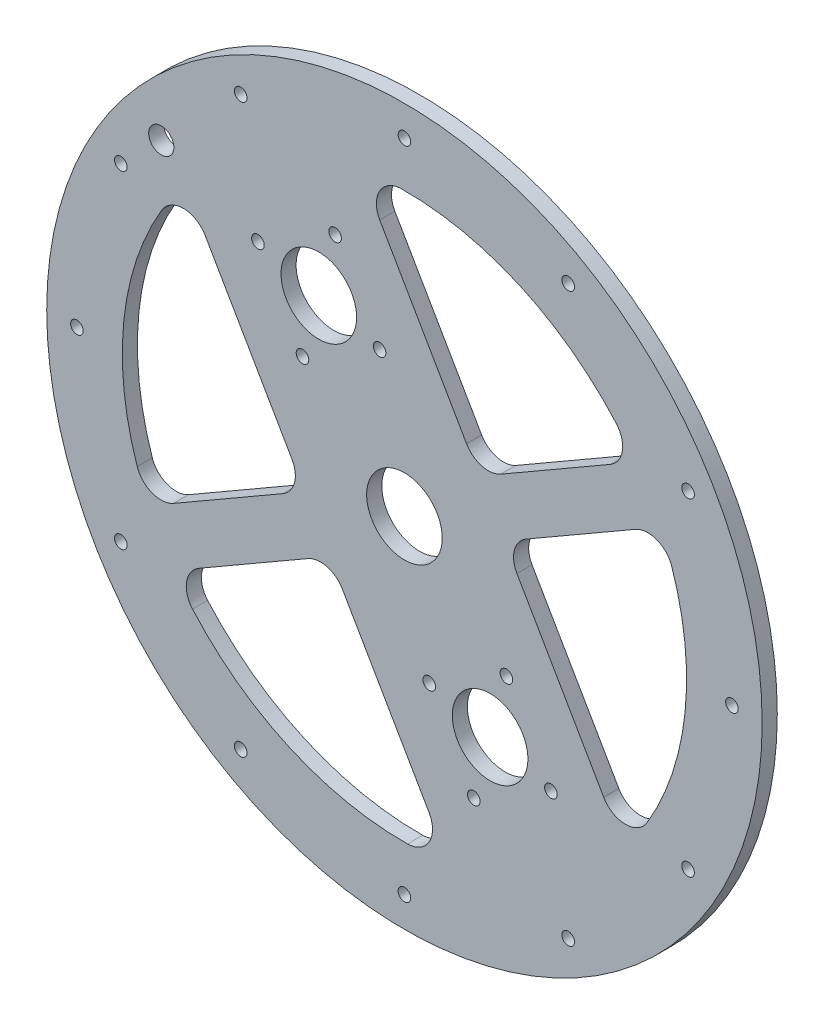
from build123d import *

# Parameters (mm, degrees)
SKETCH_1_R          = 71
SKETCH_1_R_2        = 1.25
SKETCH_1_R_3        = 7.5
EXTRUDE_1_DEPTH     = 3
CUT_EXTRUDE_1_REACH = 102.454
SKETCH_2_R          = 2.5
CUT_EXTRUDE_2_REACH = 102.454
CUT_EXTRUDE_3_REACH = 102.454
SKETCH_4_R          = 7.5
FILLET_1_R          = 5


with BuildPart() as part:
    # 草图1 → 凸台-拉伸1 (new body)
    with BuildSketch(Plane.XY):
        Circle(SKETCH_1_R)
        with Locations((0, 65)):
            Circle(SKETCH_1_R_2, mode=Mode.SUBTRACT)
        with Locations((56.291651246, 32.5)):
            Circle(SKETCH_1_R_2, mode=Mode.SUBTRACT)
        with Locations((56.291651246, -32.5)):
            Circle(SKETCH_1_R_2, mode=Mode.SUBTRACT)
        with Locations((0, -65)):
            Circle(SKETCH_1_R_2, mode=Mode.SUBTRACT)
        with Locations((-56.291651246, -32.5)):
            Circle(SKETCH_1_R_2, mode=Mode.SUBTRACT)
        with Locations((-56.291651246, 32.5)):
            Circle(SKETCH_1_R_2, mode=Mode.SUBTRACT)
        with Locations((-29.074072829, 32.680101792)):
            Circle(SKETCH_1_R_2, mode=Mode.SUBTRACT)
        with Locations((-13.764761936, 41.518936557)):
            Circle(SKETCH_1_R_2, mode=Mode.SUBTRACT)
        with Locations((-4.925927171, 26.209625665)):
            Circle(SKETCH_1_R_2, mode=Mode.SUBTRACT)
        with Locations((-20.235238064, 17.3707909)):
            Circle(SKETCH_1_R_2, mode=Mode.SUBTRACT)
        with Locations(Location((29.074072829, -32.680101792, 0), (0, 0, 180))):
            Circle(SKETCH_1_R_2, mode=Mode.SUBTRACT)
        with Locations(Location((20.235238064, -17.3707909, 0), (0, 0, 180))):
            Circle(SKETCH_1_R_2, mode=Mode.SUBTRACT)
        with Locations(Location((4.925927171, -26.209625665, 0), (0, 0, 180))):
            Circle(SKETCH_1_R_2, mode=Mode.SUBTRACT)
        with Locations(Location((13.764761936, -41.518936557, 0), (0, 0, 180))):
            Circle(SKETCH_1_R_2, mode=Mode.SUBTRACT)
        with Locations((-17, 29.444863729)):
            Circle(SKETCH_1_R_3, mode=Mode.SUBTRACT)
        with Locations(Location((17, -29.444863729, 0), (0, 0, 180))):
            Circle(SKETCH_1_R_3, mode=Mode.SUBTRACT)
        with Locations((32.5, 56.291651246)):
            Circle(SKETCH_1_R_2, mode=Mode.SUBTRACT)
        with Locations((-32.5, 56.291651246)):
            Circle(SKETCH_1_R_2, mode=Mode.SUBTRACT)
        with Locations((-65, 0)):
            Circle(SKETCH_1_R_2, mode=Mode.SUBTRACT)
        with Locations((-32.5, -56.291651246)):
            Circle(SKETCH_1_R_2, mode=Mode.SUBTRACT)
        with Locations((32.5, -56.291651246)):
            Circle(SKETCH_1_R_2, mode=Mode.SUBTRACT)
        with Locations((65, 0)):
            Circle(SKETCH_1_R_2, mode=Mode.SUBTRACT)
    extrude(amount=EXTRUDE_1_DEPTH)

    # 草图2 → 切除-拉伸1 (cut, up to next)
    with BuildSketch(Plane.XY.offset(3), mode=Mode.PRIVATE) as cut_extrude_1_sk1:
        with Locations((-48.260799916, 40.49561941)):
            Circle(SKETCH_2_R)
    cut_extrude_1_tool1 = extrude(cut_extrude_1_sk1.sketch, amount=-CUT_EXTRUDE_1_REACH, mode=Mode.PRIVATE) & part.part
    add(cut_extrude_1_tool1.solids().sort_by_distance((-48.2608, 40.495619, 3))[0], mode=Mode.SUBTRACT)

    # 草图3 → 切除-拉伸2 (cut, up to next)
    with BuildSketch(Plane.XY.offset(3), mode=Mode.PRIVATE) as cut_extrude_2_sk1:
        with BuildLine():
            Line((-43.473901737, 35.299006612), (-19.820508076, -5.669872981))
            Line((-19.820508076, -5.669872981), (-50.803726564, -23.558042516))
            ThreePointArc((-50.803726564, -23.558042516), (-55.570728424, 6.920559405), (-43.473901737, 35.299006612))
        make_face()
    cut_extrude_2_tool1 = extrude(cut_extrude_2_sk1.sketch, amount=-CUT_EXTRUDE_2_REACH, mode=Mode.PRIVATE) & part.part
    # 草图3 → 切除-拉伸2 (cut, up to next)
    with BuildSketch(Plane.XY.offset(3), mode=Mode.PRIVATE) as cut_extrude_2_sk2:
        with BuildLine():
            Line((-8.832885586, 55.299006612), (14.820508076, 14.330127019))
            Line((14.820508076, 14.330127019), (45.803726564, 32.218296554))
            ThreePointArc((45.803726564, 32.218296554), (21.791983959, 51.585942224), (-8.832885586, 55.299006612))
        make_face()
    cut_extrude_2_tool2 = extrude(cut_extrude_2_sk2.sketch, amount=-CUT_EXTRUDE_2_REACH, mode=Mode.PRIVATE) & part.part
    # 草图3 → 切除-拉伸2 (cut, up to next)
    with BuildSketch(Plane.XY.offset(3), mode=Mode.PRIVATE) as cut_extrude_2_sk3:
        with BuildLine():
            Line((19.820508076, 5.669872981), (50.803726564, 23.558042516))
            ThreePointArc((50.803726564, 23.558042516), (55.570728424, -6.920559405), (43.473901737, -35.299006612))
            Line((43.473901737, -35.299006612), (19.820508076, 5.669872981))
        make_face()
    cut_extrude_2_tool3 = extrude(cut_extrude_2_sk3.sketch, amount=-CUT_EXTRUDE_2_REACH, mode=Mode.PRIVATE) & part.part
    # 草图3 → 切除-拉伸2 (cut, up to next)
    with BuildSketch(Plane.XY.offset(3), mode=Mode.PRIVATE) as cut_extrude_2_sk4:
        with BuildLine():
            Line((-14.820508076, -14.330127019), (-45.803726564, -32.218296554))
            ThreePointArc((-45.803726564, -32.218296554), (-21.791983959, -51.585942224), (8.832885586, -55.299006612))
            Line((8.832885586, -55.299006612), (-14.820508076, -14.330127019))
        make_face()
    cut_extrude_2_tool4 = extrude(cut_extrude_2_sk4.sketch, amount=-CUT_EXTRUDE_2_REACH, mode=Mode.PRIVATE) & part.part
    add(cut_extrude_2_tool1.solids().sort_by_distance((-41.626791, 3.251163, 3))[0], mode=Mode.SUBTRACT)
    add(cut_extrude_2_tool2.solids().sort_by_distance((17.997806, 37.67544, 3))[0], mode=Mode.SUBTRACT)
    add(cut_extrude_2_tool3.solids().sort_by_distance((41.626791, -3.251163, 3))[0], mode=Mode.SUBTRACT)
    add(cut_extrude_2_tool4.solids().sort_by_distance((-17.997806, -37.67544, 3))[0], mode=Mode.SUBTRACT)

    # 草图4 → 切除-拉伸3 (cut, up to next)
    with BuildSketch(Plane.XY.offset(3), mode=Mode.PRIVATE) as cut_extrude_3_sk1:
        Circle(SKETCH_4_R)
    cut_extrude_3_tool1 = extrude(cut_extrude_3_sk1.sketch, amount=-CUT_EXTRUDE_3_REACH, mode=Mode.PRIVATE) & part.part
    add(cut_extrude_3_tool1.solids().sort_by_distance((0, 0, 3))[0], mode=Mode.SUBTRACT)

    # 圆角1
    fillet_1_edges = [part.edges().sort_by_distance(p)[0] for p in [
        (8.832885586, -55.299006612, 1.5),
        (-45.803726564, -32.218296554, 1.5),
        (-14.820508076, -14.330127019, 1.5),
        (-8.832885586, 55.299006612, 1.5),
        (45.803726564, 32.218296554, 1.5),
        (14.820508076, 14.330127019, 1.5),
        (50.803726564, 23.558042516, 1.5),
        (43.473901737, -35.299006612, 1.5),
        (19.820508076, 5.669872981, 1.5),
        (-50.803726564, -23.558042516, 1.5),
        (-43.473901737, 35.299006612, 1.5),
        (-19.820508076, -5.669872981, 1.5),
    ]]
    fillet(fillet_1_edges, radius=FILLET_1_R)


solid = part.part
